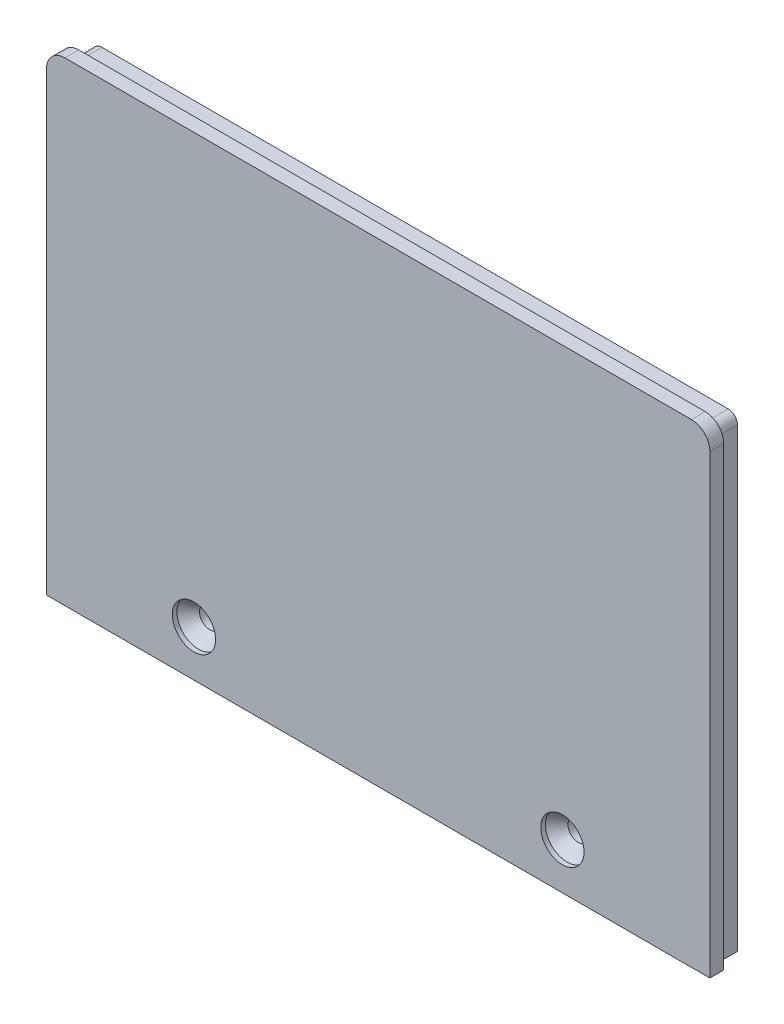
from build123d import *

# Parameters (mm, degrees)
BOSS_EXTRUDE1_DEPTH = 8
BOSS_EXTRUDE2_DEPTH = 3


with BuildPart() as part:
    # Sketch1 → Boss-Extrude1 (new body)
    with BuildSketch(Plane.XY):
        with BuildLine():
            Line((70, 0), (70, 99))
            ThreePointArc((70, 99), (69.414213562, 100.414213562), (68, 101))
            Line((68, 101), (-68, 101))
            ThreePointArc((-68, 101), (-69.414213562, 100.414213562), (-70, 99))
            Line((-70, 99), (-70, 0))
            Line((-70, 0), (70, 0))
        make_face()
    extrude(amount=BOSS_EXTRUDE1_DEPTH)

    # Sketch2 → Boss-Extrude2 (add)
    with BuildSketch(Plane.XY.offset(8)):
        with BuildLine():
            Line((72, 0), (72, 99))
            ThreePointArc((72, 99), (70.828427125, 101.828427125), (68, 103))
            Line((68, 103), (-68, 103))
            ThreePointArc((-68, 103), (-70.828427125, 101.828427125), (-72, 99))
            Line((-72, 99), (-72, 0))
            Line((-72, 0), (72, 0))
        make_face()
    extrude(amount=-BOSS_EXTRUDE2_DEPTH)

    # Sketch3 → CSK for M4 Countersunk Flat Head Screw1 (revolve, cut)
    with BuildSketch(Plane(origin=(40, 10, 8), x_dir=(0, -1, 0), z_dir=(1, 0, 0))):
        Polygon((0, 0), (0, 8), (2.25, 8), (2.25, 3.45), (4.7, 1), (4.7, 0), align=None)
    csk_for_m4_countersunk_flat_head_screw1 = revolve(axis=Axis((40, 10, 14.35), (0, 0, -1)), mode=Mode.SUBTRACT)

    # Mirror1: CSK for M4 Countersunk Flat Head Screw1 across plane
    add(csk_for_m4_countersunk_flat_head_screw1.mirror(Plane(origin=(0, 0, 0), x_dir=(0, 0, 1), z_dir=(1, 0, 0))), mode=Mode.SUBTRACT)


solid = part.part
